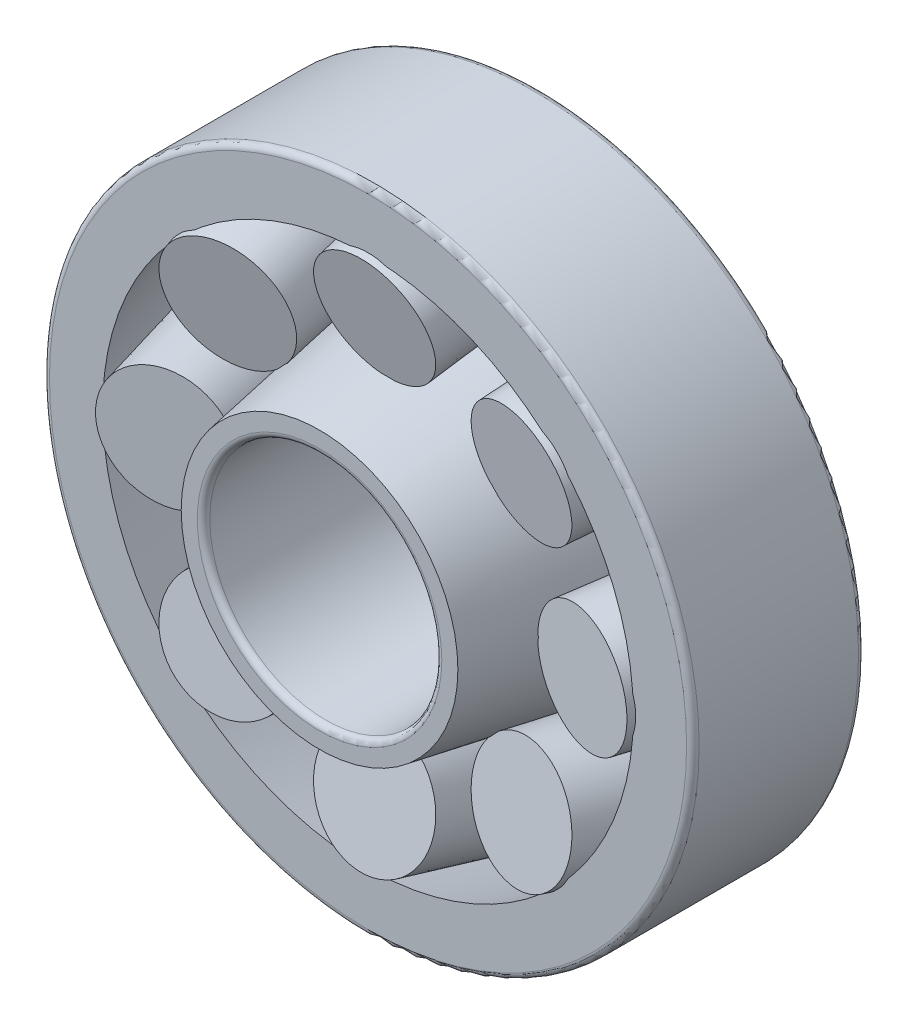
from build123d import *

# Parameters (mm, degrees)
ROLLERSPATTERN_COUNT = 8
FILLET_F1_R          = 0.405
FILLET_F2_R          = 0.405


with BuildPart() as part:
    # ConeS → Cone (revolve)
    with BuildSketch(Plane(origin=(0, 0, 0), x_dir=(1, 0, 0), z_dir=(0, 1, 0))):
        Polygon((7.5, -7.125), (8.94367725, -7.125), (11.20506675, 5.7), (7.5, 5.7), align=None)
    revolve(axis=Axis((0, 0, 11.6875), (0, 0, -1)))

    # Fillet F1
    fillet_f1_edges = [part.edges().sort_by_distance(p)[0] for p in [
        (-7.5, 0, -5.7),
        (-7.5, 0, 7.125),
    ]]
    fillet(fillet_f1_edges, radius=FILLET_F1_R)


with BuildPart() as body_2:
    # CupS → Cup (revolve)
    with BuildSketch(Plane(origin=(0, 0, 0), x_dir=(1, 0, 0), z_dir=(0, 1, 0))):
        Polygon((17.15588175, -3.99), (21, -3.99), (21, 7.125), (20.34306525, 7.125), align=None)
    revolve(axis=Axis((0, 0, 11.6875), (0, 0, -1)))

    # Fillet F2
    fillet_f2_edges = [body_2.edges().sort_by_distance(p)[0] for p in [
        (-21, 0, -7.125),
        (-21, 0, 3.99),
    ]]
    fillet(fillet_f2_edges, radius=FILLET_F2_R)


with BuildPart() as body_3:
    # RollerS → Roller (revolve)
    with BuildSketch(Plane(origin=(0, 0, 0), x_dir=(1, 0, 0), z_dir=(0, 1, 0))):
        Polygon((13.425153, -3.5625), (17.17915665, -4.43169015), (19.61867115, 4.01183385), (15.4047915, 4.9875), align=None)
    revolve(axis=Axis((15.4047915, 0, -4.9875), (-0.22556930102161163, 0, 0.9742271246668416)))


with BuildPart() as rollerspattern_1:
    # RollersPattern: pattern copy
    add(body_3.part.rotate(Axis((0, 0, -7.8375), (0, 0, 1)), 1 * 360 / ROLLERSPATTERN_COUNT))


with BuildPart() as rollerspattern_2:
    # RollersPattern: pattern copy
    add(body_3.part.rotate(Axis((0, 0, -7.8375), (0, 0, 1)), 2 * 360 / ROLLERSPATTERN_COUNT))


with BuildPart() as rollerspattern_3:
    # RollersPattern: pattern copy
    add(body_3.part.rotate(Axis((0, 0, -7.8375), (0, 0, 1)), 3 * 360 / ROLLERSPATTERN_COUNT))


with BuildPart() as rollerspattern_4:
    # RollersPattern: pattern copy
    add(body_3.part.rotate(Axis((0, 0, -7.8375), (0, 0, 1)), 4 * 360 / ROLLERSPATTERN_COUNT))


with BuildPart() as rollerspattern_5:
    # RollersPattern: pattern copy
    add(body_3.part.rotate(Axis((0, 0, -7.8375), (0, 0, 1)), 5 * 360 / ROLLERSPATTERN_COUNT))


with BuildPart() as rollerspattern_6:
    # RollersPattern: pattern copy
    add(body_3.part.rotate(Axis((0, 0, -7.8375), (0, 0, 1)), 6 * 360 / ROLLERSPATTERN_COUNT))


with BuildPart() as rollerspattern_7:
    # RollersPattern: pattern copy
    add(body_3.part.rotate(Axis((0, 0, -7.8375), (0, 0, 1)), 7 * 360 / ROLLERSPATTERN_COUNT))


solid = Compound([part.part, body_2.part, body_3.part, rollerspattern_1.part, rollerspattern_2.part, rollerspattern_3.part, rollerspattern_4.part, rollerspattern_5.part, rollerspattern_6.part, rollerspattern_7.part])
